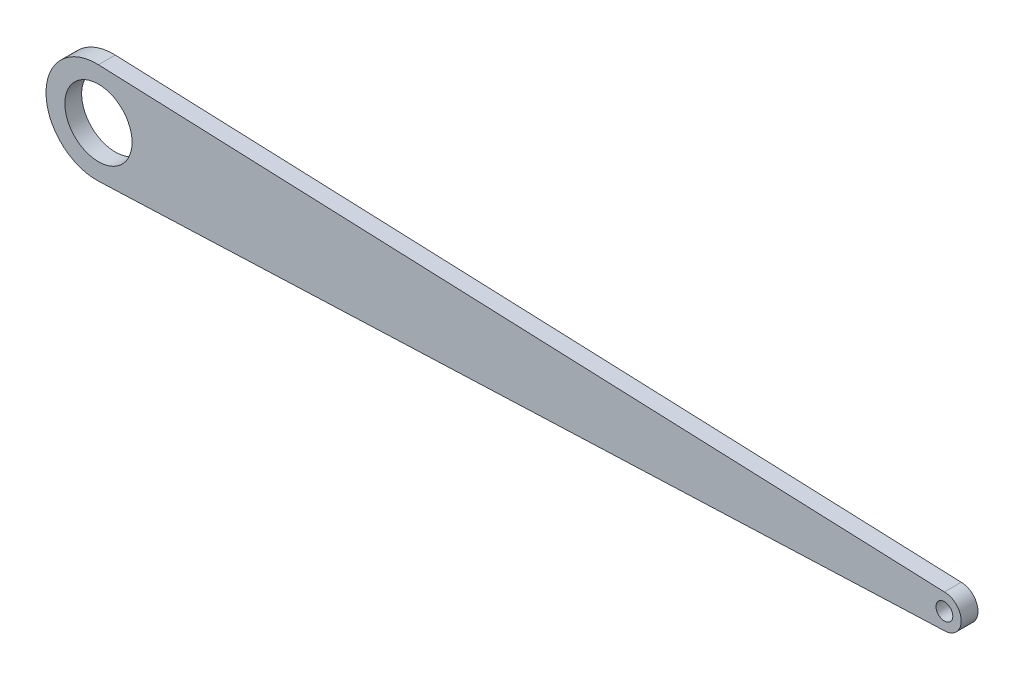
from build123d import *

# Parameters (mm, degrees)
ESBO_O1_R                = 2.5
ESBO_O1_R_2              = 10
RESSALTO_EXTRUS_O1_DEPTH = 5


with BuildPart() as part:
    # Esboço1 → Ressalto-extrusão1 (new body)
    with BuildSketch(Plane.XY):
        with BuildLine():
            Line((-125.78097799, 15), (125.89902201, 5))
            ThreePointArc((125.89902201, 5), (130.89902201, 0), (125.89902201, -5))
            Line((125.89902201, -5), (-125.78097799, -15))
            ThreePointArc((-125.78097799, -15), (-141.388808566, 0), (-125.78097799, 15))
        make_face()
        with Locations((125.89902201, 0)):
            Circle(ESBO_O1_R, mode=Mode.SUBTRACT)
        with Locations((-125.78097799, 0)):
            Circle(ESBO_O1_R_2, mode=Mode.SUBTRACT)
    extrude(amount=RESSALTO_EXTRUS_O1_DEPTH)


solid = part.part
